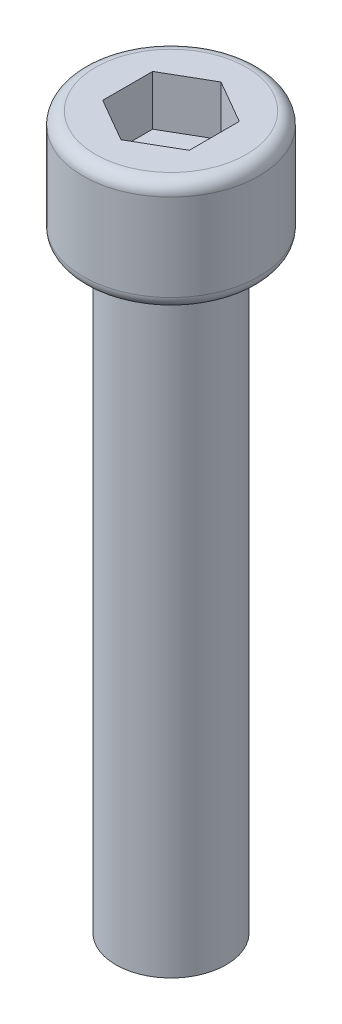
from build123d import *

# Parameters (mm, degrees)
SKETCH2_R           = 2.794
BOSS_EXTRUDE1_DEPTH = 3.556
SKETCH4_R           = 1.7526
BOSS_EXTRUDE2_DEPTH = 19.05
FILLET1_R           = 0.396875
CUT_EXTRUDE1_DEPTH  = 1.5875


with BuildPart() as part:
    # Sketch2 → Boss-Extrude1 (new body)
    with BuildSketch(Plane(origin=(0, 0, 0), x_dir=(1, 0, 0), z_dir=(0, 1, 0))):
        with Locations(Location((0, 0, 0), (0, 0, 270))):
            Circle(SKETCH2_R)
    extrude(amount=BOSS_EXTRUDE1_DEPTH)

    # Sketch4 → Boss-Extrude2 (add)
    with BuildSketch(Plane.XZ):
        with Locations(Location((0, 0, 0), (0, 0, 90))):
            Circle(SKETCH4_R)
    extrude(amount=BOSS_EXTRUDE2_DEPTH)

    # Fillet1
    fillet1_edges = [part.edges().sort_by_distance(p)[0] for p in [
        (0, 0, -2.794),
        (0, 3.556, -2.794),
    ]]
    fillet(fillet1_edges, radius=FILLET1_R)

    # Sketch5 → Cut-Extrude1 (cut)
    with BuildSketch(Plane(origin=(0, 3.556, 0), x_dir=(1, 0, 0), z_dir=(0, 1, 0))):
        Polygon((-1.374815329, 0.79375), (-1.374815329, -0.79375), (0, -1.5875), (1.374815329, -0.79375), (1.374815329, 0.79375), (0, 1.5875), align=None)
    extrude(amount=-CUT_EXTRUDE1_DEPTH, mode=Mode.SUBTRACT)


solid = part.part
